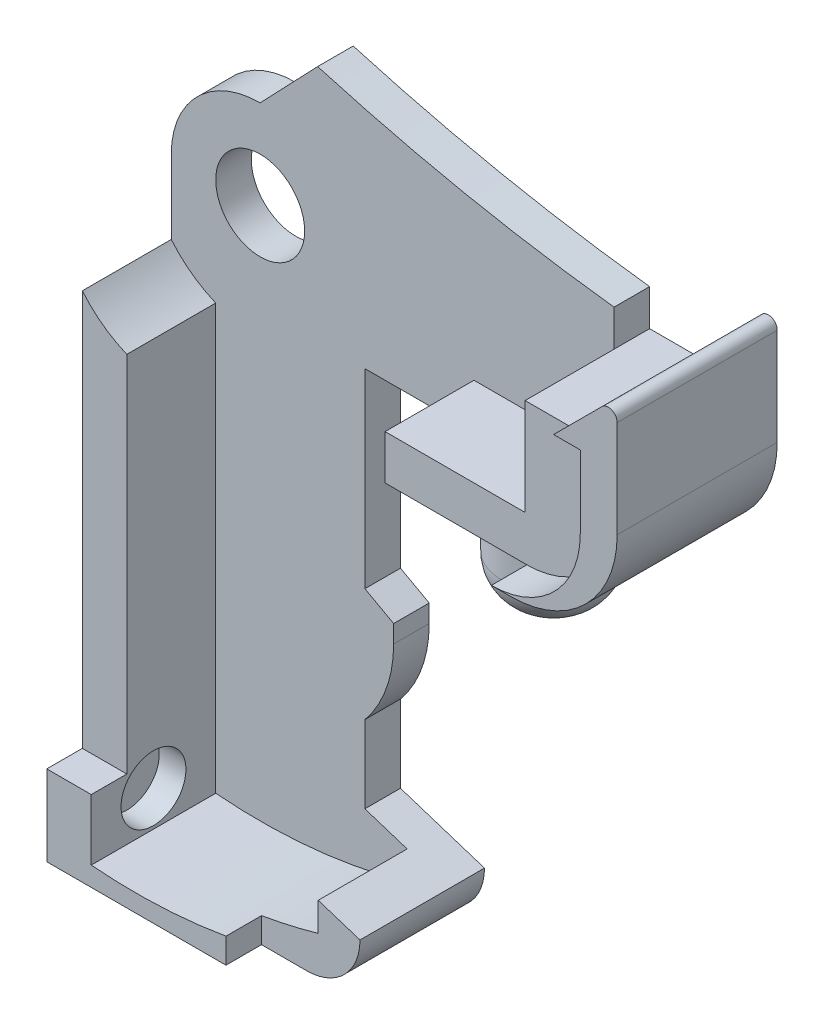
from build123d import *

# Parameters (mm, degrees)
EXTRUDE_3_DEPTH     = 9
EXTRUDE_3_2_DEPTH   = 9
EXTRUDE_4_DEPTH     = 7
SKETCH_1_8_R        = 2.5
EXTRUDE_5_DEPTH     = 2
SKETCH_2_R          = 2.9
EXTRUDE_6_DEPTH     = 2.45
SKETCH_4_R          = 2.9
EXTRUDE_7_DEPTH     = 2
FILLET_2_R          = 2.4
SKETCH_5_R          = 1.825
CUT_EXTRUDE_1_DEPTH = 1.5


with BuildPart() as part:
    # 스케치1 → 보스-돌출3 (new body)
    with BuildSketch(Plane.XY):
        with BuildLine():
            Line((-2.5, -26.437677825), (-5, -26.437677825))
            Line((-5, -26.437677825), (-5, -30.96175738))
            Line((-5, -30.96175738), (5.076141326, -30.96175738))
            Line((5.076141326, -30.96175738), (5.076141326, -29.54601506))
            ThreePointArc((5.076141326, -29.54601506), (1.298498135, -29.950761581), (-2.5, -29.874474333))
            Line((-2.5, -29.874474333), (-2.5, -26.437677825))
        make_face()
    extrude(amount=EXTRUDE_3_DEPTH)

    # 스케치1<7> → 보스-돌출4 (add)
    with BuildSketch(Plane.XY):
        with BuildLine():
            Line((23.5, 2.950728465), (19.9, 2.950728465))
            Line((19.9, 2.950728465), (19.9, -2.5))
            Line((19.9, -2.5), (12.023157318, -2.5))
            Line((12.023157318, -2.5), (12.023157318, -5))
            Line((12.023157318, -5), (20, -5))
            ThreePointArc((20, -5), (23.535533906, -3.535533906), (25, 0))
            Line((25, 0), (25, 4.09591659))
            Line((25, 4.09591659), (23.5, 4.09591659))
            Line((23.5, 4.09591659), (23.5, 2.950728465))
        make_face()
        with BuildLine():
            ThreePointArc((-2.5, -6), (-3.862002616, -5.228282299), (-5, -4.153311931))
            Line((-5, -4.153311931), (-5, -26.437677825))
            Line((-5, -26.437677825), (-2.5, -26.437677825))
            Line((-2.5, -26.437677825), (-2.5, -6))
        make_face()
        with BuildLine():
            Line((5.076141326, -29.54601506), (5.076141326, -30.96175738))
            Line((5.076141326, -30.96175738), (7.613716386, -30.96175738))
            ThreePointArc((7.613716386, -30.96175738), (9.735036729, -30.083077723), (10.613716386, -27.96175738))
            Line((10.613716386, -27.96175738), (8.264928228, -27.20398111))
            Line((8.264928228, -27.20398111), (8.264928228, -28.81709871))
            ThreePointArc((8.264928228, -28.81709871), (6.680483813, -29.225080884), (5.076141326, -29.54601506))
        make_face()
    extrude(amount=EXTRUDE_4_DEPTH)


with BuildPart() as body_2:
    # 스케치1 → Extrude 3 2 (new body)
    with BuildSketch(Plane.XY):
        with BuildLine():
            Line((26.22215467, 6.81807126), (23.5, 4.09591659))
            Line((23.5, 4.09591659), (25, 4.09591659))
            Line((25, 4.09591659), (25, 0))
            ThreePointArc((25, 0), (23.535533906, -3.535533906), (20, -5))
            Line((20, -5), (21.075708061, -5))
            ThreePointArc((21.075708061, -5), (25.318348748, -3.242640687), (27.075708061, 1))
            Line((27.075708061, 1), (27.075708061, 6.46451787))
            ThreePointArc((27.075708061, 6.46451787), (26.767049777, 6.926457636), (26.22215467, 6.81807126))
        make_face()
    extrude(amount=EXTRUDE_3_2_DEPTH)


with BuildPart() as extrude_4_piece_1:
    # of the separate pieces the step leaves, piece 1, a body of its own (extrude_4_pieces)
    add(part.part.solids().sort_by_distance((-2.5, -29.874474333, 0))[0])



with BuildPart() as extrude_4_piece_2:
    # of the separate pieces the step leaves, piece 2, a body of its own (extrude_4_pieces)
    add(part.part.solids().sort_by_distance((23.5, 2.950728465, 0))[0])


with BuildPart() as extrude_4_piece_1_1:
    add(extrude_4_piece_1.part)

    add(extrude_4_piece_2.part)  # 보스-돌출5 merges 보스-돌출4 piece 2
    # 스케치1<8> → 보스-돌출5 (add)
    with BuildSketch(Plane.XY):
        with BuildLine():
            Line((3.231912185, 8.38327913), (0, 5))
            ThreePointArc((0, 5), (-3.535533906, 3.535533906), (-5, 0))
            Line((-5, 0), (-5, -4.153311931))
            ThreePointArc((-5, -4.153311931), (-3.862002616, -5.228282299), (-2.5, -6))
            Line((-2.5, -6), (-2.5, -29.874474333))
            ThreePointArc((-2.5, -29.874474333), (2.93054776, -29.83531643), (8.264928228, -28.81709871))
            Line((8.264928228, -28.81709871), (8.264928228, -27.20398111))
            Line((8.264928228, -27.20398111), (5.889404941, -26.437579436))
            Line((5.889404941, -26.437579436), (5.889404941, -22.090836604))
            ThreePointArc((5.889404941, -22.090836604), (7.089676261, -19.98856225), (7.506209453, -17.603880133))
            Line((7.506209453, -17.603880133), (7.506209453, -16.606122356))
            Line((7.506209453, -16.606122356), (5.889404941, -15.718789718))
            Line((5.889404941, -15.718789718), (5.889404941, -5))
            Line((5.889404941, -5), (12.023157318, -5))
            Line((12.023157318, -5), (12.023157318, -2.5))
            Line((12.023157318, -2.5), (19.9, -2.5))
            Line((19.9, -2.5), (19.9, 5))
            ThreePointArc((19.9, 5), (11.496170313, 6.34783243), (3.231912185, 8.38327913))
        make_face()
        Circle(SKETCH_1_8_R, mode=Mode.SUBTRACT)
    extrude(amount=EXTRUDE_5_DEPTH)

    # 스케치2 → 보스-돌출6 (add, symmetric)
    with BuildSketch(Plane.XZ.offset(5)):
        with Locations((18, 3.5)):
            Circle(SKETCH_2_R)
    extrude(amount=EXTRUDE_6_DEPTH, both=True)

    # 스케치4 → 보스-돌출7 (add)
    with BuildSketch(Plane.XZ.offset(7.45)):
        with Locations((18, 3.5)):
            Circle(SKETCH_4_R)
    extrude(amount=EXTRUDE_7_DEPTH)

    # 필렛2
    fillet_2_edges = [extrude_4_piece_1_1.edges().sort_by_distance(p)[0] for p in [
        (15.1, -9.45, 3.5),
    ]]
    fillet(fillet_2_edges, radius=FILLET_2_R)

    # 스케치5 → 컷-돌출1 (cut)
    with BuildSketch(Plane(origin=(-2.5, 0, 0), x_dir=(0, 0, -1), z_dir=(1, 0, 0))):
        with Locations((-5.5, -27.874474333)):
            Circle(SKETCH_5_R)
    extrude(amount=-CUT_EXTRUDE_1_DEPTH, mode=Mode.SUBTRACT)


solid = Compound([body_2.part, extrude_4_piece_1_1.part])
